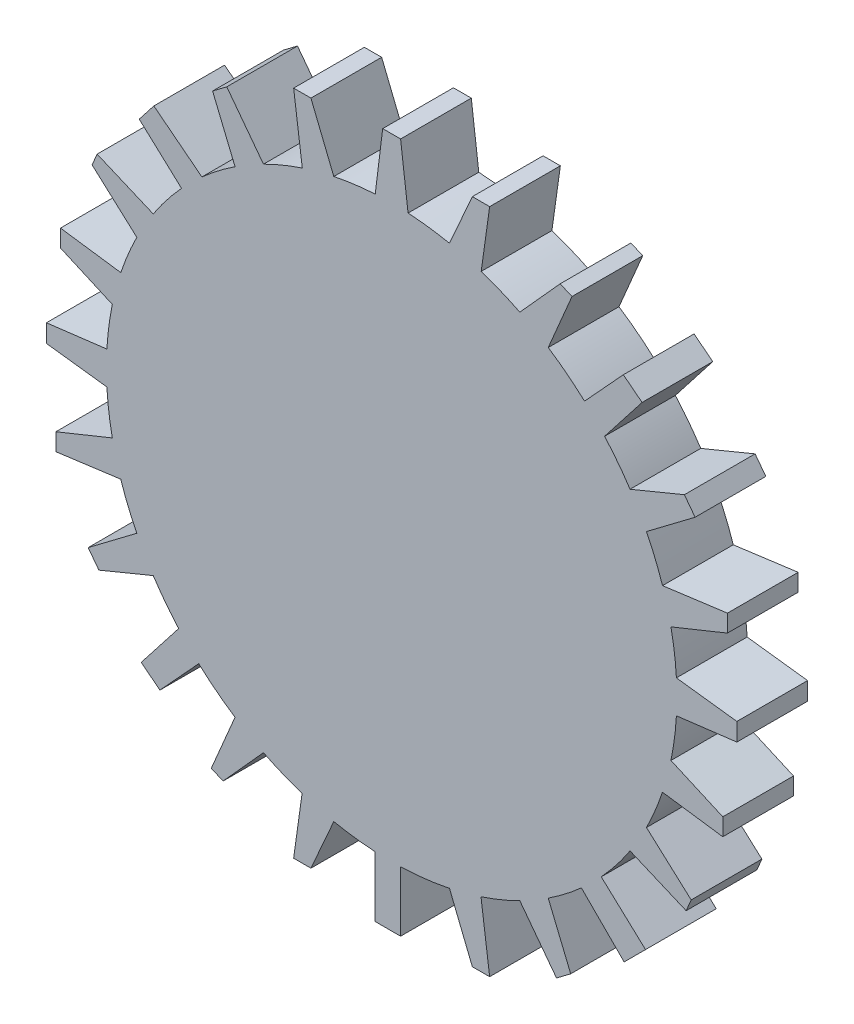
from build123d import *

# Parameters (mm, degrees)
SKETCH1_R            = 12.1
BOSS_EXTRUDE1_DEPTH  = 3
BOSS_EXTRUDE2_DEPTH  = 3
BOSS_EXTRUDE3_DEPTH  = 3
BOSS_EXTRUDE4_DEPTH  = 3
BOSS_EXTRUDE5_DEPTH  = 3
BOSS_EXTRUDE6_DEPTH  = 3
BOSS_EXTRUDE7_DEPTH  = 3
BOSS_EXTRUDE8_DEPTH  = 3
BOSS_EXTRUDE9_DEPTH  = 3
BOSS_EXTRUDE10_DEPTH = 3
BOSS_EXTRUDE11_DEPTH = 3
BOSS_EXTRUDE12_DEPTH = 3
BOSS_EXTRUDE13_DEPTH = 3
BOSS_EXTRUDE14_DEPTH = 3
BOSS_EXTRUDE15_DEPTH = 3
BOSS_EXTRUDE16_DEPTH = 3
BOSS_EXTRUDE17_DEPTH = 3
BOSS_EXTRUDE18_DEPTH = 3
BOSS_EXTRUDE19_DEPTH = 3
BOSS_EXTRUDE20_DEPTH = 3
BOSS_EXTRUDE21_DEPTH = 3
BOSS_EXTRUDE22_DEPTH = 3
BOSS_EXTRUDE23_DEPTH = 3
BOSS_EXTRUDE24_DEPTH = 3
BOSS_EXTRUDE25_DEPTH = 3


with BuildPart() as part:
    # Sketch1 → Boss-Extrude1 (new body)
    with BuildSketch(Plane.XY):
        Circle(SKETCH1_R)
    extrude(amount=BOSS_EXTRUDE1_DEPTH)

    # Sketch2 → Boss-Extrude2 (add)
    with BuildSketch(Plane.XY):
        Polygon((12.079935981, -0.696524726), (14.645079707, -0.379658233), (14.645079707, 0.379658233), (12.079935981, 0.696524726), align=None)
    extrude(amount=BOSS_EXTRUDE2_DEPTH)

    # Sketch3 → Boss-Extrude3 (add)
    with BuildSketch(Plane.XY):
        Polygon((11.848596009, 2.453726274), (14.244323498, 3.423703853), (14.244323498, 4.157147238), (11.490982299, 3.790425545), align=None)
    extrude(amount=BOSS_EXTRUDE3_DEPTH)

    # Sketch4 → Boss-Extrude4 (add)
    with BuildSketch(Plane.XY):
        Polygon((10.809793799, 5.436759883), (12.872840183, 6.993746179), (12.418878698, 7.595256676), (10.113269073, 6.643176098), align=None)
    extrude(amount=BOSS_EXTRUDE4_DEPTH)

    # Sketch5 → Boss-Extrude5 (add)
    with BuildSketch(Plane.XY):
        Polygon((9.034322006, 8.049287291), (10.624094083, 10.087176261), (9.829208044, 10.707272668), (8.182693208, 8.913671065), align=None)
    extrude(amount=BOSS_EXTRUDE5_DEPTH)

    # Sketch6 → Boss-Extrude6 (add)
    with BuildSketch(Plane.XY):
        Polygon((6.643176098, 10.113269073), (7.651333528, 12.49318195), (7.147254813, 12.706715272), (5.436759883, 10.809793799), align=None)
    extrude(amount=BOSS_EXTRUDE6_DEPTH)

    # Sketch7 → Boss-Extrude7 (add)
    with BuildSketch(Plane.XY):
        Polygon((3.799308717, 11.488048279), (4.157147238, 14.047797936), (3.423703853, 14.047797936), (2.453726274, 11.848596009), align=None)
    extrude(amount=BOSS_EXTRUDE7_DEPTH)

    # Sketch8 → Boss-Extrude8 (add)
    with BuildSketch(Plane.XY):
        Polygon((0.696524726, 12.079935981), (0.379658233, 14.645079707), (-0.379658233, 14.645079707), (-0.696524726, 12.079935981), align=None)
    extrude(amount=BOSS_EXTRUDE8_DEPTH)

    # Sketch9 → Boss-Extrude9 (add)
    with BuildSketch(Plane.XY):
        Polygon((-2.453726274, 11.848596009), (-3.423703853, 14.244323498), (-4.157147238, 14.244323498), (-3.790425545, 11.490982299), align=None)
    extrude(amount=BOSS_EXTRUDE9_DEPTH)

    # Sketch10 → Boss-Extrude10 (add)
    with BuildSketch(Plane.XY):
        Polygon((-5.436759883, 10.809793799), (-6.993746179, 12.872840183), (-7.595256676, 12.418878698), (-6.643176098, 10.113269073), align=None)
    extrude(amount=BOSS_EXTRUDE10_DEPTH)

    # Sketch11 → Boss-Extrude11 (add)
    with BuildSketch(Plane.XY):
        Polygon((-8.049287291, 9.034322006), (-10.087176261, 10.624094083), (-10.707272668, 9.829208044), (-8.913671065, 8.182693208), align=None)
    extrude(amount=BOSS_EXTRUDE11_DEPTH)

    # Sketch12 → Boss-Extrude12 (add)
    with BuildSketch(Plane.XY):
        Polygon((-10.113269073, 6.643176098), (-12.49318195, 7.651333528), (-12.706715272, 7.147254813), (-10.809793799, 5.436759883), align=None)
    extrude(amount=BOSS_EXTRUDE12_DEPTH)

    # Sketch13 → Boss-Extrude13 (add)
    with BuildSketch(Plane.XY):
        Polygon((-11.488048279, 3.799308717), (-14.047797936, 4.157147238), (-14.047797936, 3.423703853), (-11.848596009, 2.453726274), align=None)
    extrude(amount=BOSS_EXTRUDE13_DEPTH)

    # Sketch14 → Boss-Extrude14 (add)
    with BuildSketch(Plane.XY):
        Polygon((-12.079935981, 0.696524726), (-14.645079707, 0.379658233), (-14.645079707, -0.379658233), (-12.079935981, -0.696524726), align=None)
    extrude(amount=BOSS_EXTRUDE14_DEPTH)

    # Sketch15 → Boss-Extrude15 (add)
    with BuildSketch(Plane.XY):
        Polygon((-11.848596009, -2.453726274), (-14.244323498, -3.423703853), (-14.244323498, -4.157147238), (-11.490982299, -3.790425545), align=None)
    extrude(amount=BOSS_EXTRUDE15_DEPTH)

    # Sketch16 → Boss-Extrude16 (add)
    with BuildSketch(Plane.XY):
        Polygon((-10.809793799, -5.436759883), (-12.872840183, -6.993746179), (-12.418878698, -7.595256676), (-10.113269073, -6.643176098), align=None)
    extrude(amount=BOSS_EXTRUDE16_DEPTH)

    # Sketch17 → Boss-Extrude17 (add)
    with BuildSketch(Plane.XY):
        Polygon((-9.034322006, -8.049287291), (-10.624094083, -10.087176261), (-9.829208044, -10.707272668), (-8.182693208, -8.913671065), align=None)
    extrude(amount=BOSS_EXTRUDE17_DEPTH)

    # Sketch18 → Boss-Extrude18 (add)
    with BuildSketch(Plane.XY):
        Polygon((-6.643176098, -10.113269073), (-7.651333528, -12.49318195), (-7.147254813, -12.706715272), (-5.436759883, -10.809793799), align=None)
    extrude(amount=BOSS_EXTRUDE18_DEPTH)

    # Sketch19 → Boss-Extrude19 (add)
    with BuildSketch(Plane.XY):
        Polygon((-3.799308717, -11.488048279), (-4.157147238, -14.047797936), (-3.423703853, -14.047797936), (-2.453726274, -11.848596009), align=None)
    extrude(amount=BOSS_EXTRUDE19_DEPTH)

    # Sketch20 → Boss-Extrude20 (add)
    with BuildSketch(Plane.XY):
        Polygon((-0.696524726, -12.079935981), (-0.696524726, -14.645079707), (0.379658233, -14.645079707), (0.379658233, -12.09404232), align=None)
    extrude(amount=BOSS_EXTRUDE20_DEPTH)

    # Sketch21 → Boss-Extrude21 (add)
    with BuildSketch(Plane.XY):
        Polygon((2.453726274, -11.848596009), (3.423703853, -14.244323498), (4.157147238, -14.244323498), (3.790425545, -11.490982299), align=None)
    extrude(amount=BOSS_EXTRUDE21_DEPTH)

    # Sketch22 → Boss-Extrude22 (add)
    with BuildSketch(Plane.XY):
        Polygon((5.436759883, -10.809793799), (6.993746179, -12.872840183), (7.595256676, -12.418878698), (6.643176098, -10.113269073), align=None)
    extrude(amount=BOSS_EXTRUDE22_DEPTH)

    # Sketch23 → Boss-Extrude23 (add)
    with BuildSketch(Plane.XY):
        Polygon((8.049287291, -9.034322006), (9.863117815, -10.848152529), (10.770033076, -9.941237267), (8.89125817, -8.207041376), align=None)
    extrude(amount=BOSS_EXTRUDE23_DEPTH)

    # Sketch24 → Boss-Extrude24 (add)
    with BuildSketch(Plane.XY):
        Polygon((10.113269073, -6.643176098), (12.49318195, -7.651333528), (12.706715272, -7.147254813), (10.809793799, -5.436759883), align=None)
    extrude(amount=BOSS_EXTRUDE24_DEPTH)

    # Sketch25 → Boss-Extrude25 (add)
    with BuildSketch(Plane.XY):
        Polygon((11.488048279, -3.799308717), (14.047797936, -4.157147238), (14.047797936, -3.423703853), (11.848596009, -2.453726274), align=None)
    extrude(amount=BOSS_EXTRUDE25_DEPTH)


solid = part.part
